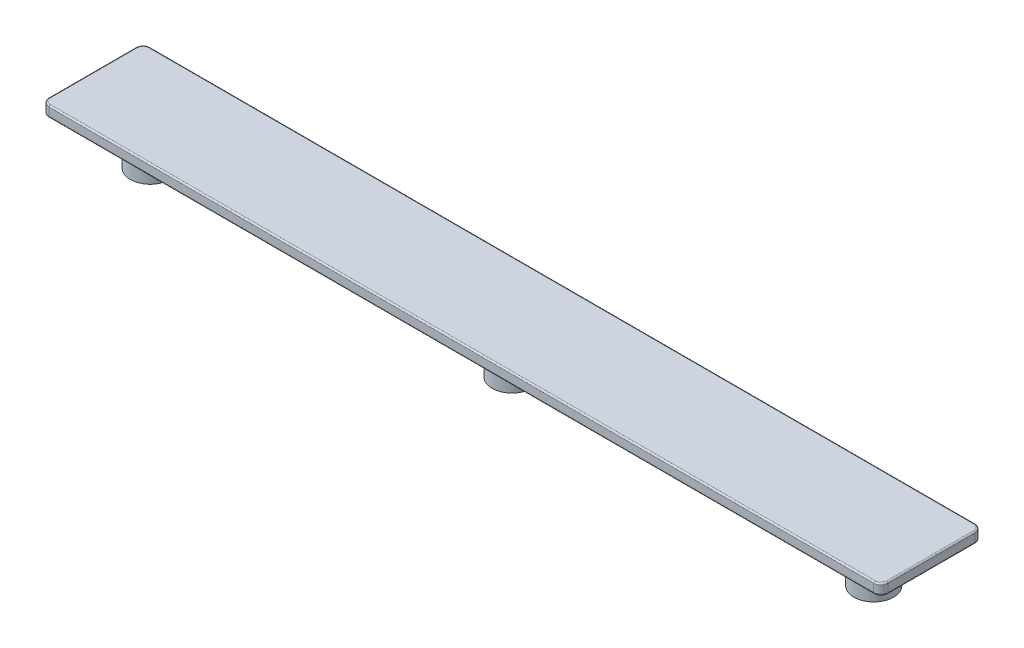
from build123d import *

# Parameters (mm, degrees)
BOSS_EXTRUDE1_DEPTH = 1.5
SKETCH2_R           = 2.75
BOSS_EXTRUDE2_DEPTH = 6
SKETCH3_W           = 1.1
SKETCH3_H           = 1.45
SKETCH3_W_2         = 1.45
SKETCH3_H_2         = 1.1
SKETCH3_W_3         = 4
SKETCH3_H_3         = 4
CUT_EXTRUDE1_DEPTH  = 6
CHAMFER1_SIZE       = 0.3
FILLET1_R           = 1
FILLET3_R           = 0.2


with BuildPart() as part:
    # Sketch1 → Boss-Extrude1 (new body)
    with BuildSketch(Plane(origin=(0, 0, 0), x_dir=(1, 0, 0), z_dir=(0, 1, 0))):
        with BuildLine():
            Line((-109.324675649, 4.396717546), (4.675324351, 4.396717546))
            ThreePointArc((4.675324351, 4.396717546), (5.382431132, 4.103824327), (5.675324351, 3.396717546))
            Line((5.675324351, 3.396717546), (5.675324351, -8.603282454))
            ThreePointArc((5.675324351, -8.603282454), (5.382431132, -9.310389235), (4.675324351, -9.603282454))
            Line((4.675324351, -9.603282454), (-109.324675649, -9.603282454))
            ThreePointArc((-109.324675649, -9.603282454), (-110.03178243, -9.310389235), (-110.324675649, -8.603282454))
            Line((-110.324675649, -8.603282454), (-110.324675649, 3.396717546))
            ThreePointArc((-110.324675649, 3.396717546), (-110.03178243, 4.103824327), (-109.324675649, 4.396717546))
        make_face()
    extrude(amount=BOSS_EXTRUDE1_DEPTH)

    # Sketch2 → Boss-Extrude2 (add)
    with BuildSketch(Plane.XZ):
        with Locations(Location((-52.324675649, 2.603282454, 0), (0, 0, 90))):
            Circle(SKETCH2_R)
        with Locations(Location((-102.324675649, 2.603282454, 0), (0, 0, 90))):
            Circle(SKETCH2_R)
        with Locations(Location((-2.324675649, 2.603282454, 0), (0, 0, 90))):
            Circle(SKETCH2_R)
    extrude(amount=BOSS_EXTRUDE2_DEPTH)

    # Sketch3 → Cut-Extrude1 (cut)
    with BuildSketch(Plane.XZ.offset(6)):
        with Locations((-52.324675649, 3.878282454)):
            Rectangle(SKETCH3_W, SKETCH3_H)
        with Locations((-51.049675649, 2.603282454)):
            Rectangle(SKETCH3_W_2, SKETCH3_H_2)
        with Locations((-52.324675649, 2.603282454)):
            Rectangle(SKETCH3_W, SKETCH3_H_2)
        with Locations((-53.599675649, 2.603282454)):
            Rectangle(SKETCH3_W_2, SKETCH3_H_2)
        with Locations((-52.324675649, 1.328282454)):
            Rectangle(SKETCH3_W, SKETCH3_H)
        with Locations((-2.53698339, 2.603282454)):
            Rectangle(SKETCH3_W_3, SKETCH3_H_2)
        with Locations((-2.53698339, 2.603282454)):
            Rectangle(SKETCH3_W, SKETCH3_H_3)
        with Locations((-102.324675649, 2.603282454)):
            Rectangle(SKETCH3_W, SKETCH3_H_3)
        with Locations((-102.324675649, 2.603282454)):
            Rectangle(SKETCH3_W_3, SKETCH3_H_2)
    extrude(amount=-CUT_EXTRUDE1_DEPTH, mode=Mode.SUBTRACT)

    # Chamfer1
    chamfer1_edges = [part.edges().sort_by_distance(p)[0] for p in [
        (-1.26198339, -6, 2.053282454),
        (-3.08698339, -6, 3.878282454),
        (-4.53698339, -6, 2.603282454),
        (-3.81198339, -6, 2.053282454),
        (-3.08698339, -6, 1.328282454),
        (-2.53698339, -6, 0.603282454),
        (-3.81198339, -6, 3.153282454),
        (-0.53698339, -6, 2.603282454),
        (-1.26198339, -6, 3.153282454),
        (-2.53698339, -6, 4.603282454),
        (-1.98698339, -6, 3.878282454),
        (-1.98698339, -6, 1.328282454),
        (-103.599675649, -6, 2.053282454),
        (-102.874675649, -6, 1.328282454),
        (-102.324675649, -6, 0.603282454),
        (-101.049675649, -6, 2.053282454),
        (-102.874675649, -6, 3.878282454),
        (-104.324675649, -6, 2.603282454),
        (-102.324675649, -6, 4.603282454),
        (-101.774675649, -6, 3.878282454),
        (-101.774675649, -6, 1.328282454),
        (-100.324675649, -6, 2.603282454),
        (-101.049675649, -6, 3.153282454),
        (-103.599675649, -6, 3.153282454),
        (-51.774675649, -6, 3.878282454),
        (-51.049675649, -6, 3.153282454),
        (-50.324675649, -6, 2.603282454),
        (-51.774675649, -6, 1.328282454),
        (-53.599675649, -6, 3.153282454),
        (-52.324675649, -6, 4.603282454),
        (-52.874675649, -6, 3.878282454),
        (-54.324675649, -6, 2.603282454),
        (-53.599675649, -6, 2.053282454),
        (-52.874675649, -6, 1.328282454),
        (-52.324675649, -6, 0.603282454),
        (-51.049675649, -6, 2.053282454),
    ]]
    chamfer(chamfer1_edges, length=CHAMFER1_SIZE)

    # Fillet1
    fillet1_edges = [part.edges().sort_by_distance(p)[0] for p in [
        (-52.324675649, 0, -0.146717546),
        (-102.324675649, 0, -0.146717546),
        (-2.324675649, 0, -0.146717546),
    ]]
    fillet(fillet1_edges, radius=FILLET1_R)

    # Fillet3
    fillet3_edges = [part.edges().sort_by_distance(p)[0] for p in [
        (5.382431132, 1.5, 9.310389235),
        (-52.324675649, 0, 9.603282454),
        (-110.03178243, 0, 9.310389235),
        (5.675324351, 1.5, 2.603282454),
        (5.382431132, 1.5, -4.103824327),
        (-52.324675649, 1.5, -4.396717546),
        (-110.03178243, 1.5, -4.103824327),
        (-110.324675649, 1.5, 2.603282454),
        (-110.03178243, 1.5, 9.310389235),
        (-52.324675649, 1.5, 9.603282454),
        (-110.324675649, 0, 2.603282454),
        (-110.03178243, 0, -4.103824327),
        (-52.324675649, 0, -4.396717546),
        (5.382431132, 0, -4.103824327),
        (5.675324351, 0, 2.603282454),
        (5.382431132, 0, 9.310389235),
    ]]
    fillet(fillet3_edges, radius=FILLET3_R)


solid = part.part
